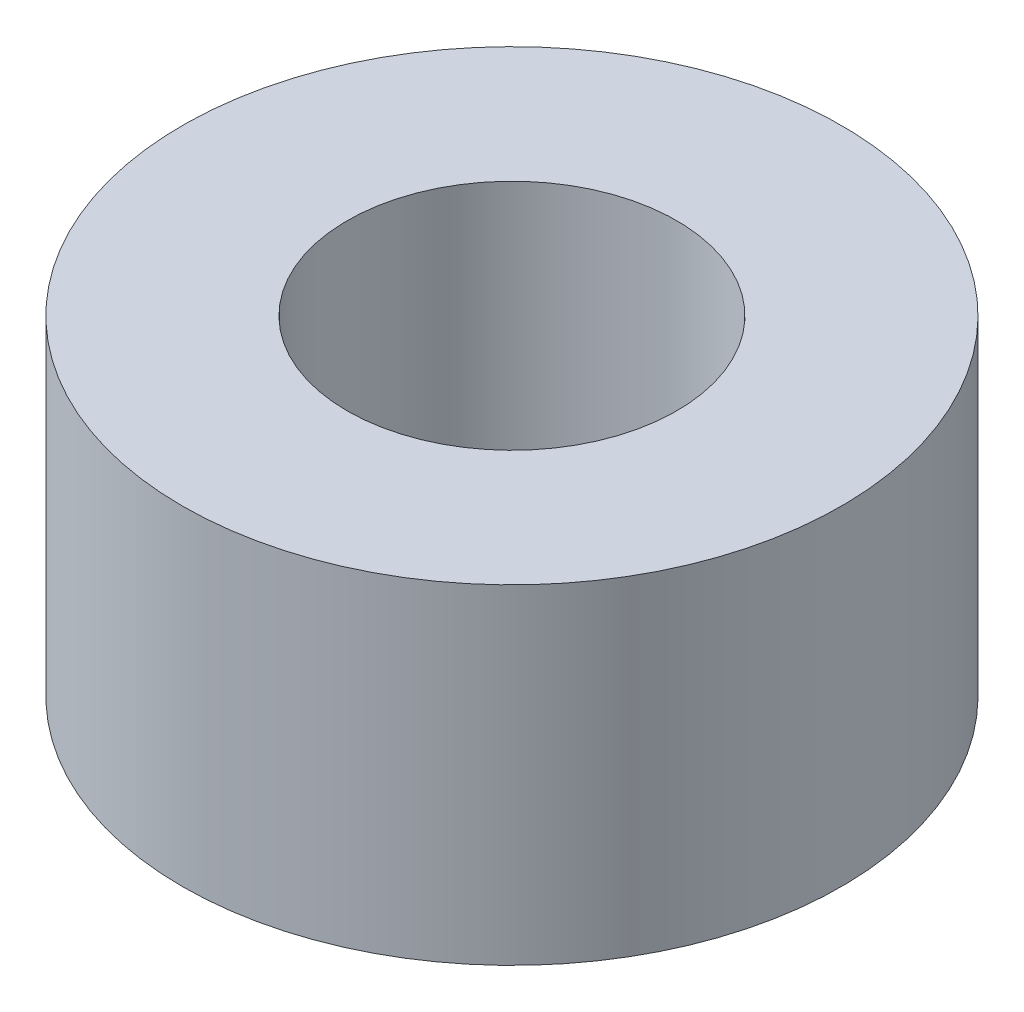
from build123d import *

# Parameters (mm, degrees)
SKETCH_1_R      = 6
SKETCH_1_R_2    = 3
EXTRUDE_1_DEPTH = 6


with BuildPart() as part:
    # 草图1 → 凸台-拉伸1 (new body)
    with BuildSketch(Plane(origin=(0, 0, 0), x_dir=(1, 0, 0), z_dir=(0, 1, 0))):
        with Locations(Location((0, 0, 0), (0, 0, 270))):
            Circle(SKETCH_1_R)
        with Locations(Location((0, 0, 0), (0, 0, 270))):
            Circle(SKETCH_1_R_2, mode=Mode.SUBTRACT)
    extrude(amount=EXTRUDE_1_DEPTH)


solid = part.part
